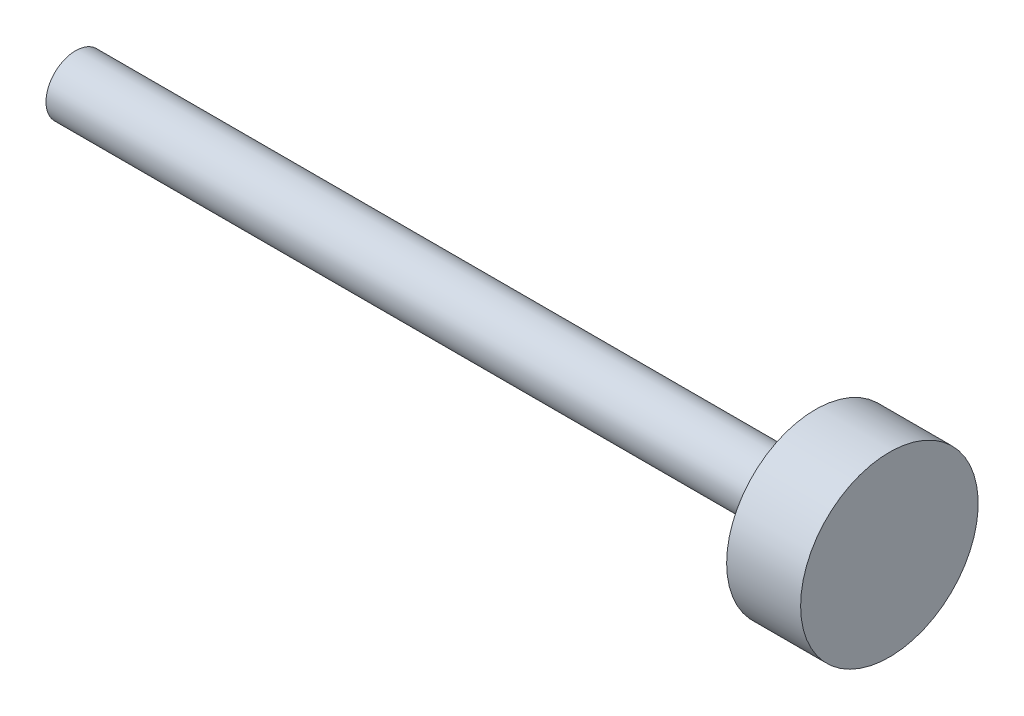
from build123d import *


with BuildPart() as part:
    # Esquisse1 → Révolution1 (revolve)
    with BuildSketch(Plane.XY, mode=Mode.PRIVATE) as r_volution1_sk:
        Polygon((58.104587718, 0), (58.104587718, 12), (48.104587718, 12), (48.104587718, 4), (-51.895412282, 4), (-51.895412282, 0), align=None)
    revolve(r_volution1_sk.sketch.rotate(Axis((-51.895412282, 0, 0), (1, 0, 0)), 90), axis=Axis((-51.895412282, 0, 0), (1, 0, 0)))


solid = part.part
